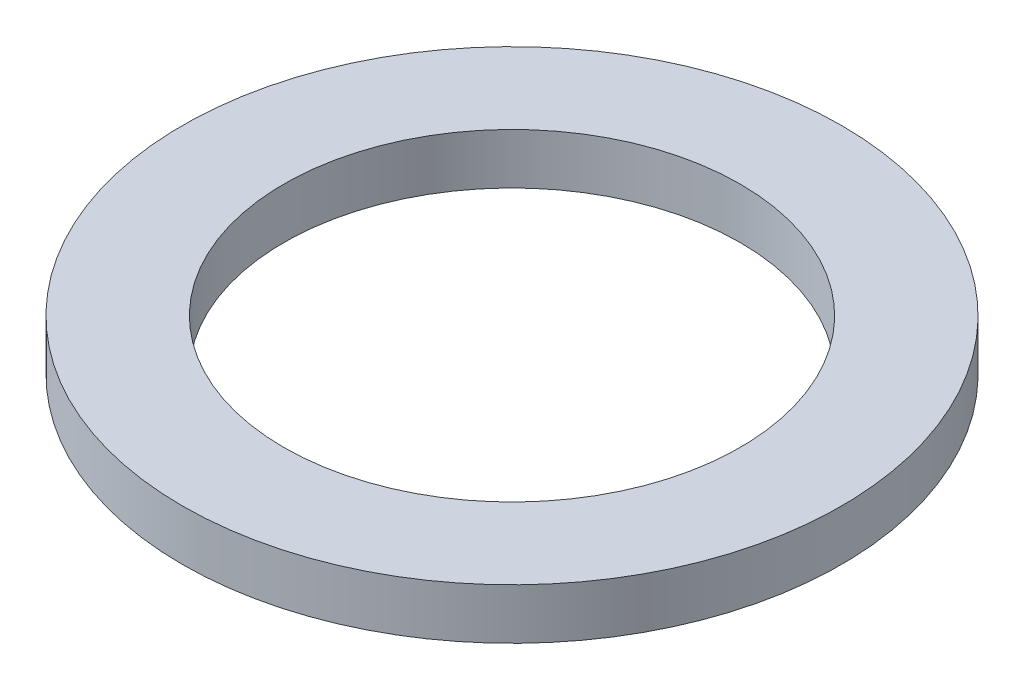
from build123d import *

# Parameters (mm, degrees)
ESQUISSE1_R        = 3.25
ESQUISSE1_R_2      = 2.25
BOSS_EXTRU_1_DEPTH = 0.5


with BuildPart() as part:
    # Esquisse1 → Boss.-Extru.1 (new body)
    with BuildSketch(Plane(origin=(0, 0, 0), x_dir=(1, 0, 0), z_dir=(0, 1, 0))):
        with Locations(Location((0, 0, 0), (0, 0, 270))):
            Circle(ESQUISSE1_R)
        with Locations(Location((0, 0, 0), (0, 0, 270))):
            Circle(ESQUISSE1_R_2, mode=Mode.SUBTRACT)
    extrude(amount=BOSS_EXTRU_1_DEPTH)


solid = part.part
